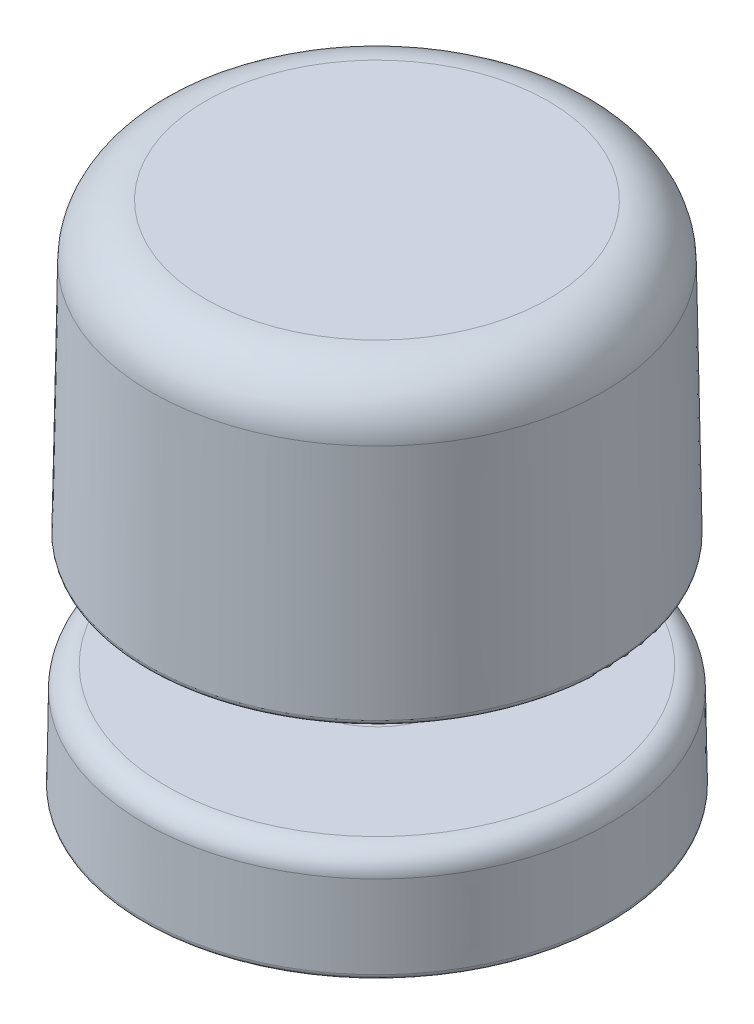
from build123d import *

# Parameters (mm, degrees)
F_1_4_0_25_DIAMETER_HOLE1_D     = 6.35
F_1_4_0_25_DIAMETER_HOLE1_DEPTH = 10
F_1_4_0_25_DIAMETER_HOLE1_TIP   = 1.907732465


with BuildPart() as part:
    # Sketch1 → Revolve1 (revolve)
    with BuildSketch(Plane.XY, mode=Mode.PRIVATE) as revolve1_sk:
        with BuildLine():
            Line((0, 47), (15.766125633, 47))
            ThreePointArc((15.766125633, 47), (19.270671954, 45.566252246), (20.765364109, 42.087262032))
            Line((20.765364109, 42.087262032), (21.142018853, 20.508726203))
            ThreePointArc((21.142018853, 20.508726203), (20.99872023, 20.149545368), (20.642095005, 20))
            Line((20.642095005, 20), (7, 20))
            ThreePointArc((7, 20), (5.585786438, 19.414213562), (5, 18))
            Line((5, 18), (5, 12))
            ThreePointArc((5, 12), (5.585786438, 10.585786438), (7, 10))
            Line((7, 10), (19.360054824, 10))
            ThreePointArc((19.360054824, 10), (20.761873353, 9.426500898), (21.359750215, 8.034904813))
            Line((21.359750215, 8.034904813), (21.491120151, 0.508726203))
            ThreePointArc((21.491120151, 0.508726203), (21.347821528, 0.149545368), (20.991196304, 0))
            Line((20.991196304, 0), (0, 0))
            Line((0, 0), (0, 47))
        make_face()
    revolve(revolve1_sk.sketch.rotate(Axis((0, 0, 0), (0, 1, 0)), 90), axis=Axis((0, 0, 0), (0, 1, 0)))

    # 1/4 (0.25) Diameter Hole1
    with Locations(Plane(origin=(0, 0, 0), x_dir=(-1, 0, 0), z_dir=(0, -1, 0))):
        with Locations((0, 0)):
            Hole(F_1_4_0_25_DIAMETER_HOLE1_D / 2, depth=F_1_4_0_25_DIAMETER_HOLE1_DEPTH)
            with Locations((0, 0, -(F_1_4_0_25_DIAMETER_HOLE1_DEPTH + F_1_4_0_25_DIAMETER_HOLE1_TIP / 2))):  # 118° drill point
                Cone(0, F_1_4_0_25_DIAMETER_HOLE1_D / 2, F_1_4_0_25_DIAMETER_HOLE1_TIP, mode=Mode.SUBTRACT)


solid = part.part
